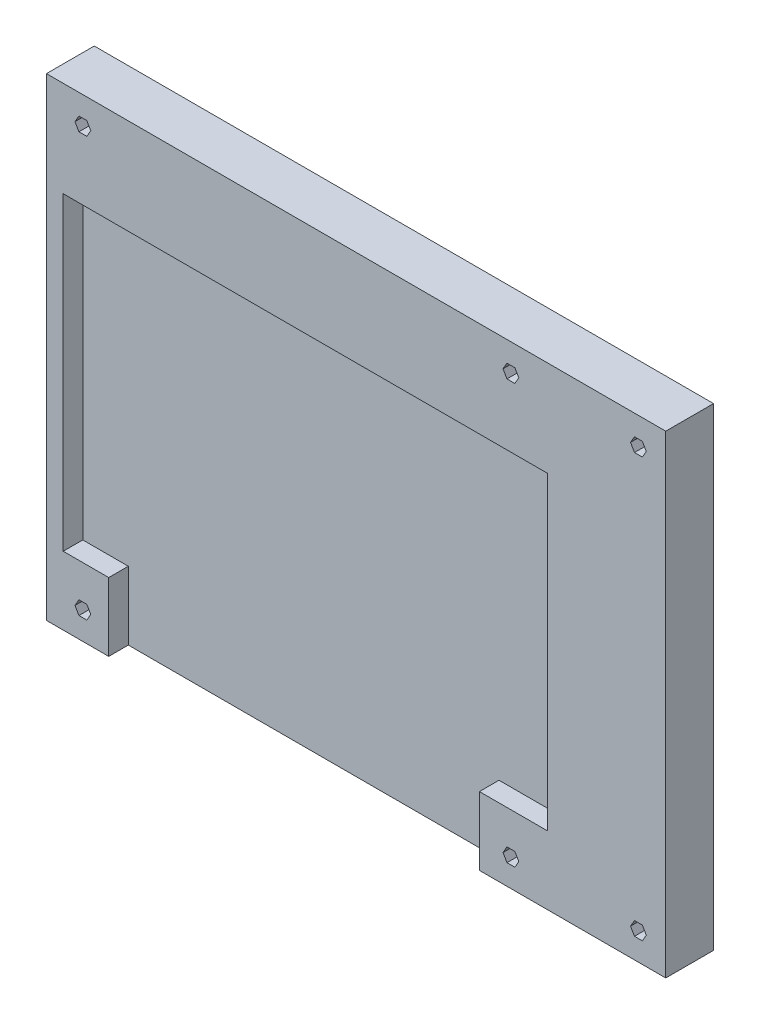
from build123d import *

# Parameters (mm, degrees)
SKETCH_1_W             = 136
SKETCH_1_H             = 104
EXTRUDE_1_DEPTH        = 10.5
CUT_EXTRUDE_1428_DEPTH = 4.3
CUT_EXTRUDE_1767_REACH = 173.529
SKETCH_4_W             = 20.267949192
SKETCH_4_H             = 35
PCB_DEPTH              = 3


with BuildPart() as part:
    # 草图1 → 凸台-拉伸1 (new body)
    with BuildSketch(Plane.XY):
        with Locations((68, 52)):
            Rectangle(SKETCH_1_W, SKETCH_1_H)
    extrude(amount=-EXTRUDE_1_DEPTH)

    # 草图1<3> → Cut-Extrude 1428 (cut)
    with BuildSketch(Plane.XY):
        Polygon((13.68, 15), (13.68, 0), (95.08, 0), (95.08, 15), (110.08, 15), (110.08, 83), (3.68, 83), (3.68, 15), align=None)
    extrude(amount=-CUT_EXTRUDE_1428_DEPTH, mode=Mode.SUBTRACT)

    # 草图1<5> → Cut-Extrude 1767 (cut, up to next)
    with BuildSketch(Plane.XY, mode=Mode.PRIVATE) as cut_extrude_1767_sk1:
        Polygon((8.866025404, 4.5), (9.732050808, 6), (8.866025404, 7.5), (7.133974596, 7.5), (6.267949192, 6), (7.133974596, 4.5), align=None)
    cut_extrude_1767_tool1 = extrude(cut_extrude_1767_sk1.sketch, amount=-CUT_EXTRUDE_1767_REACH, mode=Mode.PRIVATE) & part.part
    # 草图1<5> → Cut-Extrude 1767 (cut, up to next)
    with BuildSketch(Plane.XY, mode=Mode.PRIVATE) as cut_extrude_1767_sk2:
        Polygon((129.133974596, 7.5), (128.267949192, 6), (129.133974596, 4.5), (130.866025404, 4.5), (131.732050808, 6), (130.866025404, 7.5), align=None)
    cut_extrude_1767_tool2 = extrude(cut_extrude_1767_sk2.sketch, amount=-CUT_EXTRUDE_1767_REACH, mode=Mode.PRIVATE) & part.part
    # 草图1<5> → Cut-Extrude 1767 (cut, up to next)
    with BuildSketch(Plane.XY, mode=Mode.PRIVATE) as cut_extrude_1767_sk3:
        Polygon((130.866025404, 96.5), (131.732050808, 98), (130.866025404, 99.5), (129.133974596, 99.5), (128.267949192, 98), (129.133974596, 96.5), align=None)
    cut_extrude_1767_tool3 = extrude(cut_extrude_1767_sk3.sketch, amount=-CUT_EXTRUDE_1767_REACH, mode=Mode.PRIVATE) & part.part
    # 草图1<5> → Cut-Extrude 1767 (cut, up to next)
    with BuildSketch(Plane.XY, mode=Mode.PRIVATE) as cut_extrude_1767_sk4:
        Polygon((8.866025404, 96.5), (9.732050808, 98), (8.866025404, 99.5), (7.133974596, 99.5), (6.267949192, 98), (7.133974596, 96.5), align=None)
    cut_extrude_1767_tool4 = extrude(cut_extrude_1767_sk4.sketch, amount=-CUT_EXTRUDE_1767_REACH, mode=Mode.PRIVATE) & part.part
    # 草图1<5> → Cut-Extrude 1767 (cut, up to next)
    with BuildSketch(Plane.XY, mode=Mode.PRIVATE) as cut_extrude_1767_sk5:
        Polygon((102.866025404, 99.5), (101.133974596, 99.5), (100.267949192, 98), (101.133974596, 96.5), (102.866025404, 96.5), (103.732050808, 98), align=None)
    cut_extrude_1767_tool5 = extrude(cut_extrude_1767_sk5.sketch, amount=-CUT_EXTRUDE_1767_REACH, mode=Mode.PRIVATE) & part.part
    # 草图1<5> → Cut-Extrude 1767 (cut, up to next)
    with BuildSketch(Plane.XY, mode=Mode.PRIVATE) as cut_extrude_1767_sk6:
        Polygon((102.866025404, 4.5), (103.732050808, 6), (102.866025404, 7.5), (101.133974596, 7.5), (100.267949192, 6), (101.133974596, 4.5), align=None)
    cut_extrude_1767_tool6 = extrude(cut_extrude_1767_sk6.sketch, amount=-CUT_EXTRUDE_1767_REACH, mode=Mode.PRIVATE) & part.part
    add(cut_extrude_1767_tool1.solids().sort_by_distance((8, 6, 0))[0], mode=Mode.SUBTRACT)
    add(cut_extrude_1767_tool2.solids().sort_by_distance((130, 6, 0))[0], mode=Mode.SUBTRACT)
    add(cut_extrude_1767_tool3.solids().sort_by_distance((130, 98, 0))[0], mode=Mode.SUBTRACT)
    add(cut_extrude_1767_tool4.solids().sort_by_distance((8, 98, 0))[0], mode=Mode.SUBTRACT)
    add(cut_extrude_1767_tool5.solids().sort_by_distance((102, 98, 0))[0], mode=Mode.SUBTRACT)
    add(cut_extrude_1767_tool6.solids().sort_by_distance((102, 6, 0))[0], mode=Mode.SUBTRACT)

    # 草图4 → PCB插件坑 (cut)
    with BuildSketch(Plane(origin=(0, 0, -10.5), x_dir=(-1, 0, 0), z_dir=(0, 0, -1))):
        with Locations((-10.133974596, 27)):
            Rectangle(SKETCH_4_W, SKETCH_4_H)
    extrude(amount=-PCB_DEPTH, mode=Mode.SUBTRACT)


solid = part.part
